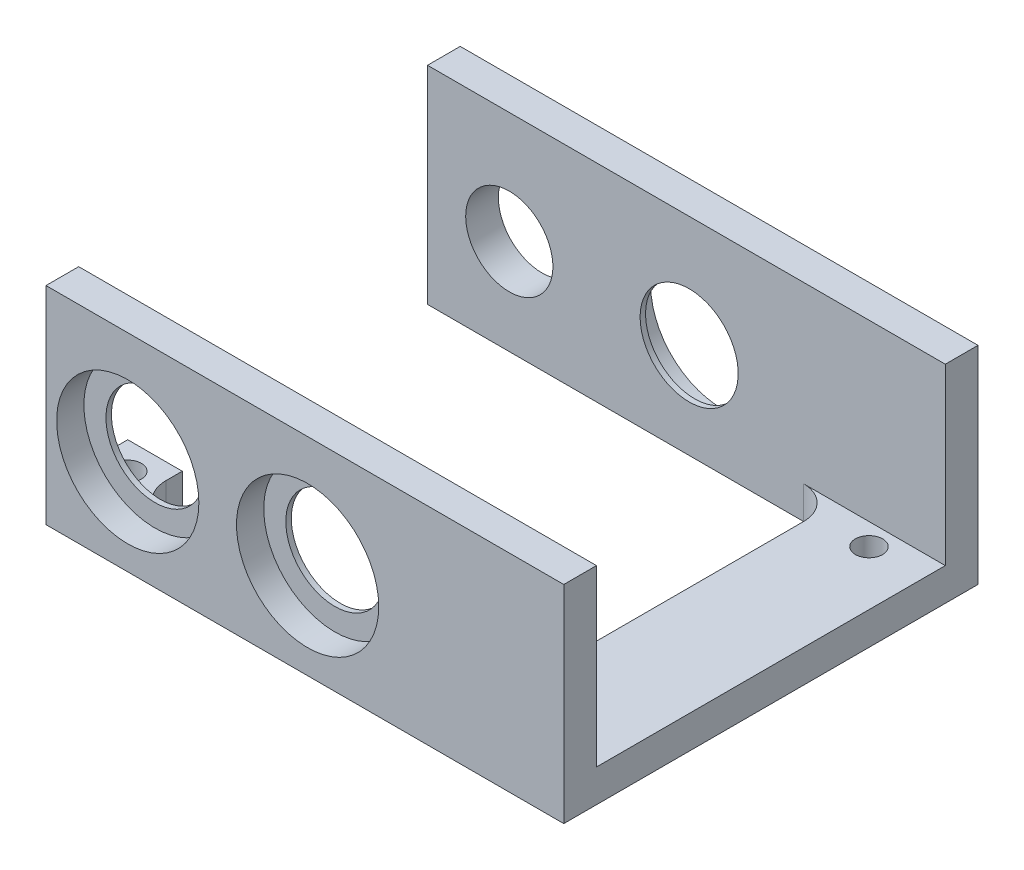
from build123d import *

# Parameters (mm, degrees)
SKETCH1_W           = 95
SKETCH1_H           = 38
BOSS_EXTRUDE1_DEPTH = 6
SKETCH2_W           = 95
SKETCH2_H           = 38
BOSS_EXTRUDE2_DEPTH = 6
SKETCH11_W          = 20.001105266
SKETCH11_H          = 64
BOSS_EXTRUDE5_DEPTH = 6
SKETCH13_W          = 10
SKETCH13_H          = 9
BOSS_EXTRUDE7_DEPTH = 6
SKETCH16_R          = 9
CUT_EXTRUDE2_DEPTH  = 6
SKETCH20_R          = 13.05
CUT_EXTRUDE3_DEPTH  = 5
CUT_EXTRUDE4_START  = -6
SKETCH21_R          = 8
SKETCH21_R_2        = 9
CUT_EXTRUDE4_DEPTH  = 6
CUT_EXTRUDE5_START  = -5
SKETCH22_R          = 13.05
CUT_EXTRUDE5_DEPTH  = 5
SKETCH25_R          = 2.5
CUT_EXTRUDE6_DEPTH  = 6
FILLET2_R           = 6


with BuildPart() as part:
    # Sketch1 → Boss-Extrude1 (new body)
    with BuildSketch(Plane.XY):
        with Locations((7.938087136, 9.487020953)):
            Rectangle(SKETCH1_W, SKETCH1_H)
    extrude(amount=BOSS_EXTRUDE1_DEPTH)



with BuildPart() as body_2:
    # Sketch2 → Boss-Extrude2 (new body)
    with BuildSketch(Plane.XY.offset(70)):
        with Locations((7.938087136, 9.487020953)):
            Rectangle(SKETCH2_W, SKETCH2_H)
    extrude(amount=BOSS_EXTRUDE2_DEPTH)


with BuildPart() as part_1:
    add(part.part)

    add(body_2.part)  # Boss-Extrude5 merges body 2
    # Sketch11 → Boss-Extrude5 (add)
    with BuildSketch(Plane(origin=(0, -9.512979047, 0), x_dir=(-1, 0, 0), z_dir=(0, -1, 0))):
        with Locations((-45.437534503, -38)):
            Rectangle(SKETCH11_W, SKETCH11_H)
    extrude(amount=-BOSS_EXTRUDE5_DEPTH)

    # Sketch13 → Boss-Extrude7 (add)
    with BuildSketch(Plane(origin=(0, -9.512979047, 0), x_dir=(-1, 0, 0), z_dir=(0, -1, 0))):
        with Locations((34.561912864, -65.5)):
            Rectangle(SKETCH13_W, SKETCH13_H)
    extrude(amount=-BOSS_EXTRUDE7_DEPTH)

    # Sketch16 → Cut-Extrude2 (cut)
    with BuildSketch(Plane.XY.offset(76)):
        with Locations((-24.561912864, 7.987020953)):
            Circle(SKETCH16_R)
        with Locations((8.438087136, 7.987020953)):
            Circle(SKETCH16_R)
    extrude(amount=-CUT_EXTRUDE2_DEPTH, mode=Mode.SUBTRACT)

    # Sketch20 → Cut-Extrude3 (cut)
    with BuildSketch(Plane.XY.offset(76)):
        with Locations((-24.561912864, 7.987020953)):
            Circle(SKETCH20_R)
        with Locations((8.438087136, 7.987020953)):
            Circle(SKETCH20_R)
    extrude(amount=-CUT_EXTRUDE3_DEPTH, mode=Mode.SUBTRACT)

    # Sketch21 → Cut-Extrude4 (cut)
    with BuildSketch(Plane(origin=(0, 0, 0), x_dir=(-1, 0, 0), z_dir=(0, 0, -1)).offset(CUT_EXTRUDE4_START)):
        with Locations((24.561912864, 7.987020953)):
            Circle(SKETCH21_R)
        with Locations(Location((-8.438087136, 7.987020953, 0), (0, 0, 180))):
            Circle(SKETCH21_R_2)
    extrude(amount=CUT_EXTRUDE4_DEPTH, mode=Mode.SUBTRACT)

    # Sketch22 → Cut-Extrude5 (cut)
    with BuildSketch(Plane(origin=(0, 0, 0), x_dir=(-1, 0, 0), z_dir=(0, 0, -1)).offset(CUT_EXTRUDE5_START)):
        with Locations(Location((-8.438087136, 7.987020953, 0), (0, 0, 180))):
            Circle(SKETCH22_R)
    extrude(amount=CUT_EXTRUDE5_DEPTH, mode=Mode.SUBTRACT)

    # Sketch25 → Cut-Extrude6 (cut)
    with BuildSketch(Plane(origin=(0, -3.512979047, 0), x_dir=(1, 0, 0), z_dir=(0, 1, 0))):
        with Locations(Location((45.437534503, -10, 0), (0, 0, 270))):
            Circle(SKETCH25_R)
        with Locations(Location((45.437534503, -66, 0), (0, 0, 270))):
            Circle(SKETCH25_R)
        with Locations(Location((-34.561912864, -66, 0), (0, 0, 270))):
            Circle(SKETCH25_R)
    extrude(amount=-CUT_EXTRUDE6_DEPTH, mode=Mode.SUBTRACT)

    # Fillet2
    fillet2_edges = [part_1.edges().sort_by_distance(p)[0] for p in [
        (35.43698187, -6.512979047, 6),
        (35.43698187, -6.512979047, 70),
        (-29.561912864, -6.512979047, 70),
    ]]
    fillet(fillet2_edges, radius=FILLET2_R)


solid = part_1.part
